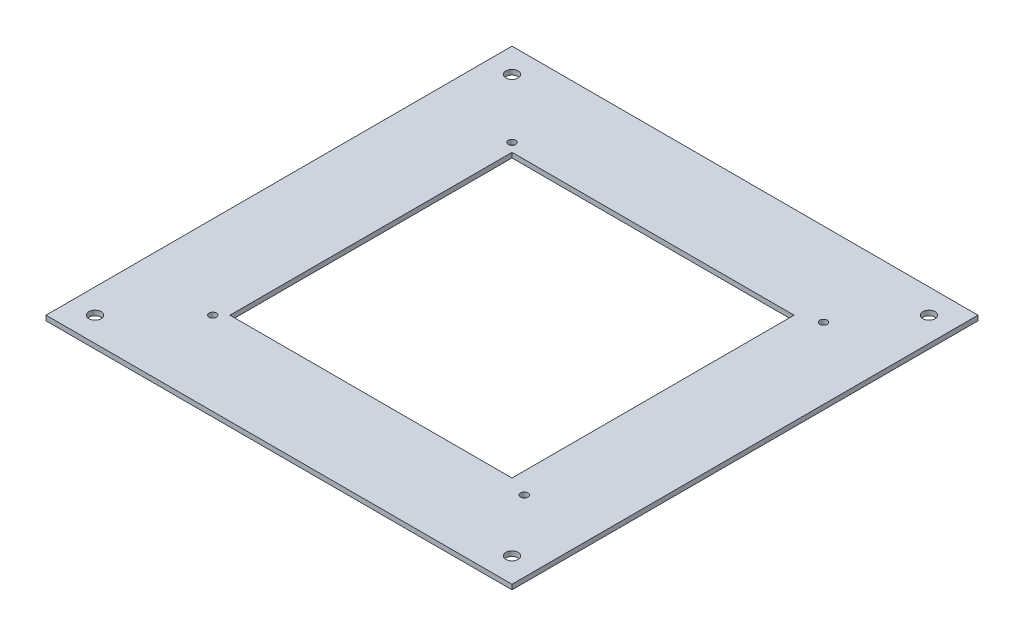
from build123d import *

# Parameters (mm, degrees)
CROQUIS1_W              = 190
CROQUIS1_H              = 190
CROQUIS1_R              = 2.5
CROQUIS1_R_2            = 1.5
CROQUIS1_W_2            = 115
CROQUIS1_H_2            = 115
SALIENTE_EXTRUIR1_DEPTH = 2


with BuildPart() as part:
    # Croquis1 → Saliente-Extruir1 (new body)
    with BuildSketch(Plane(origin=(0, 0, 0), x_dir=(1, 0, 0), z_dir=(0, 1, 0))):
        Rectangle(CROQUIS1_W, CROQUIS1_H)
        with Locations(Location((-85, 85, 0), (0, 0, 270))):
            Circle(CROQUIS1_R, mode=Mode.SUBTRACT)
        with Locations(Location((85, 85, 0), (0, 0, 270))):
            Circle(CROQUIS1_R, mode=Mode.SUBTRACT)
        with Locations(Location((85, -85, 0), (0, 0, 270))):
            Circle(CROQUIS1_R, mode=Mode.SUBTRACT)
        with Locations(Location((-85, -85, 0), (0, 0, 270))):
            Circle(CROQUIS1_R, mode=Mode.SUBTRACT)
        with Locations(Location((-61, 61, 0), (0, 0, 270))):
            Circle(CROQUIS1_R_2, mode=Mode.SUBTRACT)
        with Locations(Location((66, 61, 0), (0, 0, 270))):
            Circle(CROQUIS1_R_2, mode=Mode.SUBTRACT)
        with Locations(Location((66, -61, 0), (0, 0, 270))):
            Circle(CROQUIS1_R_2, mode=Mode.SUBTRACT)
        with Locations(Location((-61, -61, 0), (0, 0, 270))):
            Circle(CROQUIS1_R_2, mode=Mode.SUBTRACT)
        Rectangle(CROQUIS1_W_2, CROQUIS1_H_2, mode=Mode.SUBTRACT)
    extrude(amount=SALIENTE_EXTRUIR1_DEPTH)


solid = part.part
